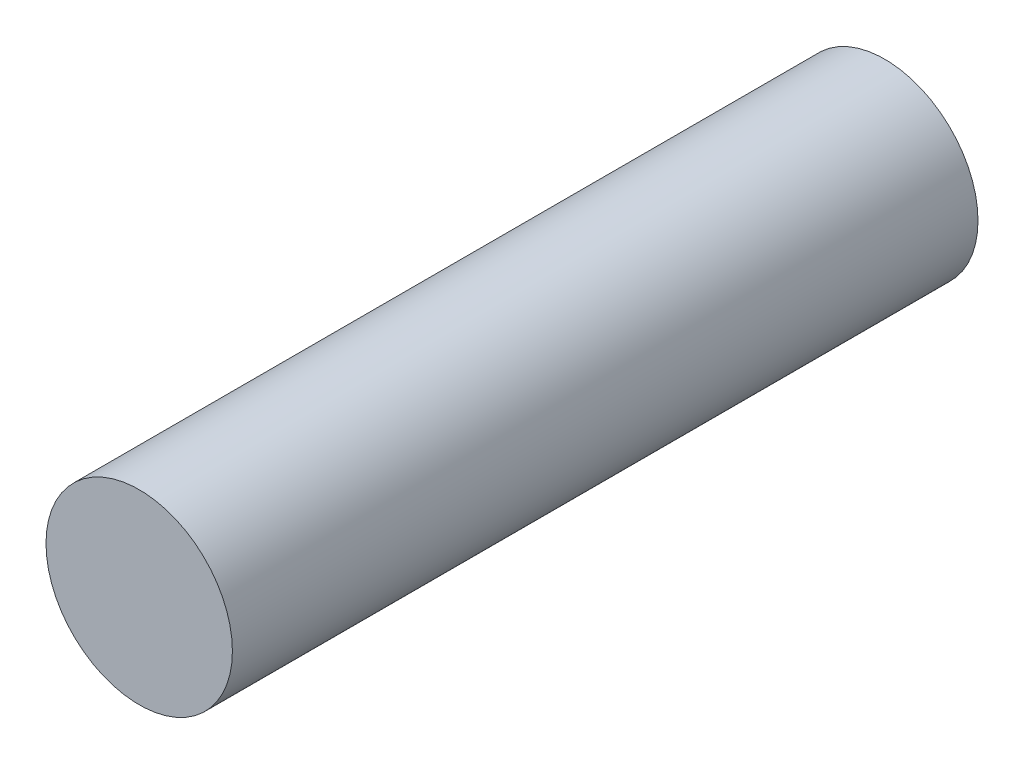
from build123d import *

# Parameters (mm, degrees)
SKETCH1_R           = 50
BOSS_EXTRUDE1_DEPTH = 400


with BuildPart() as part:
    # Sketch1 → Boss-Extrude1 (new body)
    with BuildSketch(Plane.XY):
        Circle(SKETCH1_R)
    extrude(amount=BOSS_EXTRUDE1_DEPTH)


solid = part.part
